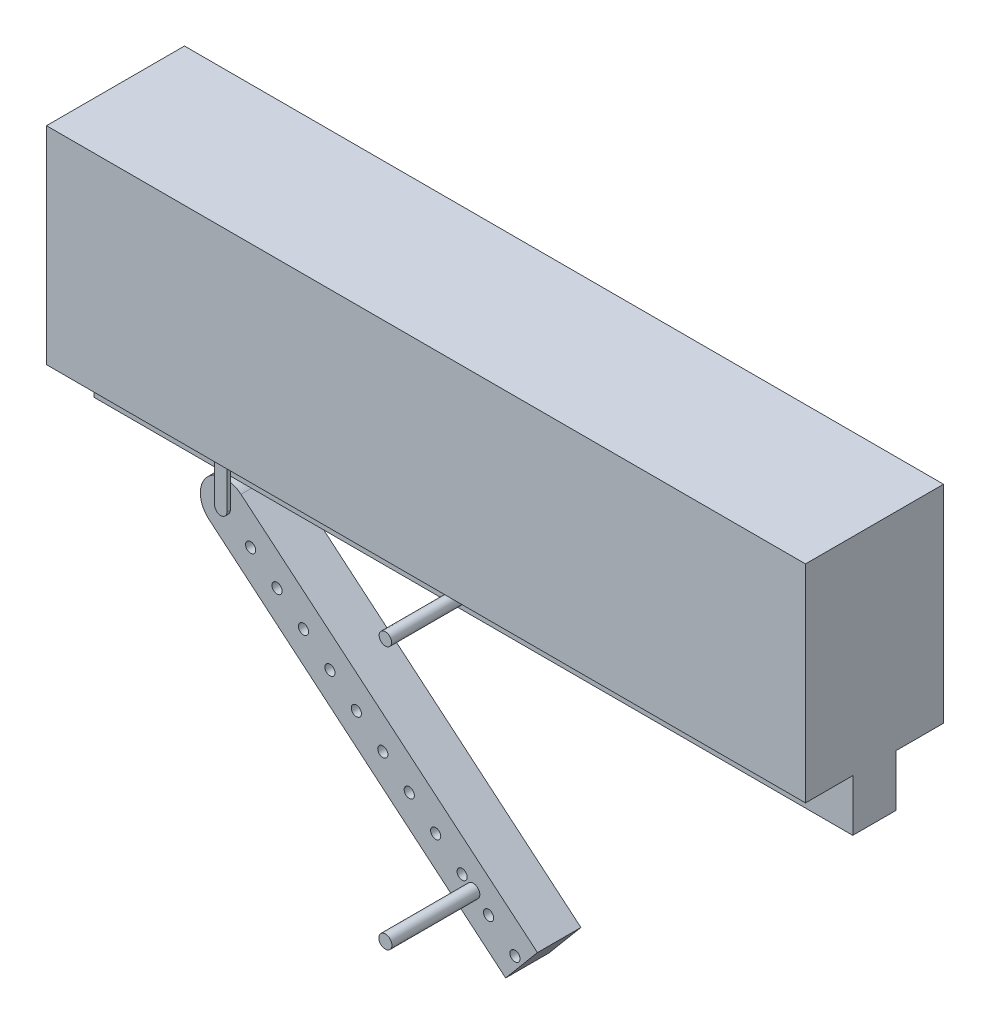
from build123d import *

# Parameters (mm, degrees)
BOSS_EXTRU_4_DEPTH         = 550
BOSS_EXTRU_4_DEPTH_BACK    = 550
ESQUISSE7_W                = 63
ESQUISSE7_H                = 75
ESQUISSE3_R                = 10
ENL_V_MAT_EXTRU_2_DEPTH    = 1056.909601573
BOSS_EXTRU_5_DEPTH         = 63
BOSS_EXTRU_6_DEPTH         = 5
ESQUISSE12_R               = 7.355365699
ENL_V_MAT_EXTRU_3_DEPTH    = 100
R_P_TITION_LIN_AIRE2_COUNT = 12
R_P_TITION_LIN_AIRE2_PITCH = 50
BOSS_EXTRU_7_REACH         = 1057.91
ESQUISSE13_R               = 9.503964929
R_P_TITION_LIN_AIRE3_COUNT = 2
R_P_TITION_LIN_AIRE3_PITCH = 66
ESQUISSE14_R               = 9
BOSS_EXTRU_8_DEPTH         = 326
ESQUISSE15_W               = 200
ESQUISSE15_H               = 300
BOSS_EXTRU_9_DEPTH         = 1100


with BuildPart() as part:
    # Esquisse7 → Boss.-Extru.4 (new, two sides: drawn at the far end of the back side and taken through both)
    with BuildSketch(Plane.ZY.offset(-237.5).offset(-BOSS_EXTRU_4_DEPTH_BACK)):
        with Locations((167.0850662, 639.649163537)):
            Rectangle(ESQUISSE7_W, ESQUISSE7_H)
    extrude(amount=BOSS_EXTRU_4_DEPTH + BOSS_EXTRU_4_DEPTH_BACK)

    # Esquisse3 → Enlèv. mat.-Extru.2 (cut, through all)
    with BuildSketch(Plane.XY.offset(326)):
        with Locations((237.5, 637.5)):
            Circle(ESQUISSE3_R)
    extrude(amount=-ENL_V_MAT_EXTRU_2_DEPTH, mode=Mode.SUBTRACT)



with BuildPart() as body_2:
    # Esquisse11 → Boss.-Extru.5 (new body)
    with BuildSketch(Plane.XY.offset(198.5850662)):
        with BuildLine():
            Line((330.503621206, 226.557033524), (-99.153084709, 586.914270743))
            ThreePointArc((-99.153084709, 586.914270743), (-149.651047416, 582.484624891), (-145.221401564, 531.986662185))
            Line((-145.221401564, 531.986662185), (284.435304351, 171.629424966))
            Line((284.435304351, 171.629424966), (330.503621206, 226.557033524))
        make_face()
    extrude(amount=-BOSS_EXTRU_5_DEPTH)


with BuildPart() as part_1:
    add(part.part)

    add(body_2.part)  # Boss.-Extru.6 merges body 2
    # Esquisse11<3> → Boss.-Extru.6 (add)
    with BuildSketch(Plane.XY.offset(198.5850662)):
        with BuildLine():
            ThreePointArc((-114.54998443, 643.613737641), (-123.445013511, 652.508766722), (-132.340042592, 643.613737641))
            Line((-132.340042592, 643.613737641), (-132.340042592, 559.450466464))
            ThreePointArc((-132.340042592, 559.450466464), (-123.445013511, 550.555437383), (-114.54998443, 559.450466464))
            Line((-114.54998443, 559.450466464), (-114.54998443, 643.613737641))
        make_face()
    boss_extru_6 = extrude(amount=BOSS_EXTRU_6_DEPTH)

    # Esquisse12 → Enlèv. mat.-Extru.3 (cut)
    with BuildSketch(Plane.XY.offset(198.5850662)):
        with Locations((-123.445013511, 559.450466464)):
            Circle(ESQUISSE12_R)
    enl_v_mat_extru_3 = extrude(amount=-ENL_V_MAT_EXTRU_3_DEPTH, mode=Mode.SUBTRACT)

    # Répétition linéaire2: Enlèv. mat.-Extru.3 ×12
    with Locations(*[Vector(0.7661915431257937, -0.6426122619764698, 0) * (i * R_P_TITION_LIN_AIRE2_PITCH) for i in range(1, R_P_TITION_LIN_AIRE2_COUNT)]):
        add(enl_v_mat_extru_3, mode=Mode.SUBTRACT)

    # Esquisse13 → Boss.-Extru.7 (add, up to next)
    with BuildSketch(Plane.XY.offset(326), mode=Mode.PRIVATE) as boss_extru_7_sk1:
        with Locations((237.5, 257.608372702)):
            Circle(ESQUISSE13_R)
    boss_extru_7_tool1 = extrude(boss_extru_7_sk1.sketch, amount=-BOSS_EXTRU_7_REACH, mode=Mode.PRIVATE) - part_1.part
    add(boss_extru_7_tool1.solids().sort_by_distance((237.5, 257.608373, 326))[0])

    # Répétition linéaire3: Boss.-Extru.6 ×2
    with Locations(*[(0, 0, -i * R_P_TITION_LIN_AIRE3_PITCH) for i in range(1, R_P_TITION_LIN_AIRE3_COUNT)]):
        add(boss_extru_6)

    # Esquisse15 → Boss.-Extru.9 (add)
    with BuildSketch(Plane.ZY.offset(312.5)):
        with Locations((167.0850662, 827.149163537)):
            Rectangle(ESQUISSE15_W, ESQUISSE15_H)
    extrude(amount=-BOSS_EXTRU_9_DEPTH)


with BuildPart() as body_2_2:
    # Esquisse14 → Boss.-Extru.8 (new body)
    with BuildSketch(Plane.XY.offset(326)):
        with Locations((237.5, 637.5)):
            Circle(ESQUISSE14_R)
    extrude(amount=-BOSS_EXTRU_8_DEPTH)


solid = Compound([part_1.part, body_2_2.part])
